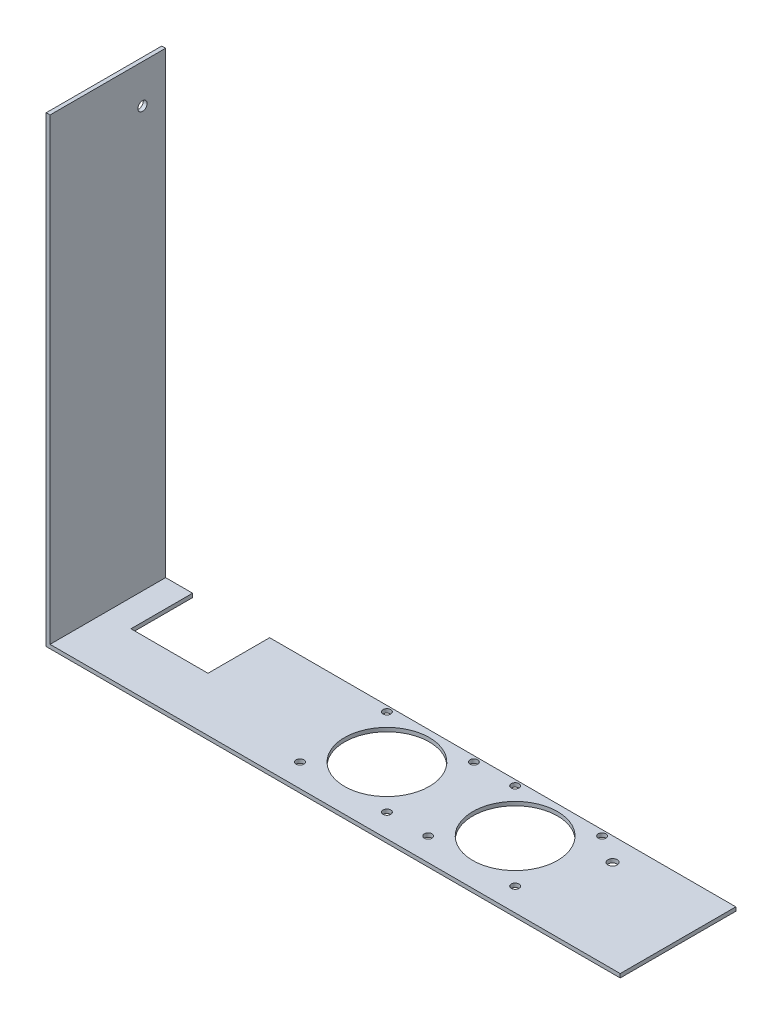
from build123d import *

# Parameters (mm, degrees)
BOSS_EXTRUDE1_DEPTH = 95.25
SKETCH2_R           = 3.175
CUT_EXTRUDE1_DEPTH  = 152.4
SKETCH4_R           = 34.925
SKETCH4_R_2         = 3.81
CUT_EXTRUDE2_DEPTH  = 381
SKETCH5_R           = 3.81
CUT_EXTRUDE3_DEPTH  = 12.7
SKETCH6_W           = 63.5
SKETCH6_H           = 50.8
CUT_EXTRUDE4_DEPTH  = 76.708


with BuildPart() as part:
    # Sketch1 → Boss-Extrude1 (new body)
    with BuildSketch(Plane.XY):
        Polygon((0, 0), (0, 381), (3.175, 381), (3.175, 3.175), (473.075, 3.175), (473.075, 0), align=None)
    extrude(amount=BOSS_EXTRUDE1_DEPTH)

    # Sketch2 → Cut-Extrude1 (cut)
    with BuildSketch(Plane(origin=(0, 3.175, 0), x_dir=(1, 0, 0), z_dir=(0, 1, 0))):
        with Locations(Location((190.119, -4.572, 0), (0, 0, 180))):
            Circle(SKETCH2_R)
        with Locations(Location((190.119, -76.2, 0), (0, 0, 180))):
            Circle(SKETCH2_R)
        with Locations(Location((261.747, -4.572, 0), (0, 0, 180))):
            Circle(SKETCH2_R)
        with Locations(Location((261.747, -76.2, 0), (0, 0, 180))):
            Circle(SKETCH2_R)
        with Locations(Location((295.783, -76.2, 0), (0, 0, 180))):
            Circle(SKETCH2_R)
        with Locations(Location((295.783, -4.572, 0), (0, 0, 180))):
            Circle(SKETCH2_R)
        with Locations(Location((367.411, -76.2, 0), (0, 0, 180))):
            Circle(SKETCH2_R)
        with Locations(Location((367.411, -4.572, 0), (0, 0, 180))):
            Circle(SKETCH2_R)
    extrude(amount=-CUT_EXTRUDE1_DEPTH, mode=Mode.SUBTRACT)

    # Sketch4 → Cut-Extrude2 (cut)
    with BuildSketch(Plane.XZ):
        with Locations((225.933, 40.386)):
            Circle(SKETCH4_R)
        with Locations((331.597, 40.386)):
            Circle(SKETCH4_R)
        with Locations((390.525, 19.05)):
            Circle(SKETCH4_R_2)
    extrude(amount=-CUT_EXTRUDE2_DEPTH, mode=Mode.SUBTRACT)

    # Sketch5 → Cut-Extrude3 (cut)
    with BuildSketch(Plane.ZY):
        with Locations((19.05, 349.25)):
            Circle(SKETCH5_R)
    extrude(amount=-CUT_EXTRUDE3_DEPTH, mode=Mode.SUBTRACT)

    # Sketch6 → Cut-Extrude4 (cut)
    with BuildSketch(Plane.XZ):
        with Locations((57.15, 25.4)):
            Rectangle(SKETCH6_W, SKETCH6_H)
    extrude(amount=-CUT_EXTRUDE4_DEPTH, mode=Mode.SUBTRACT)


solid = part.part
